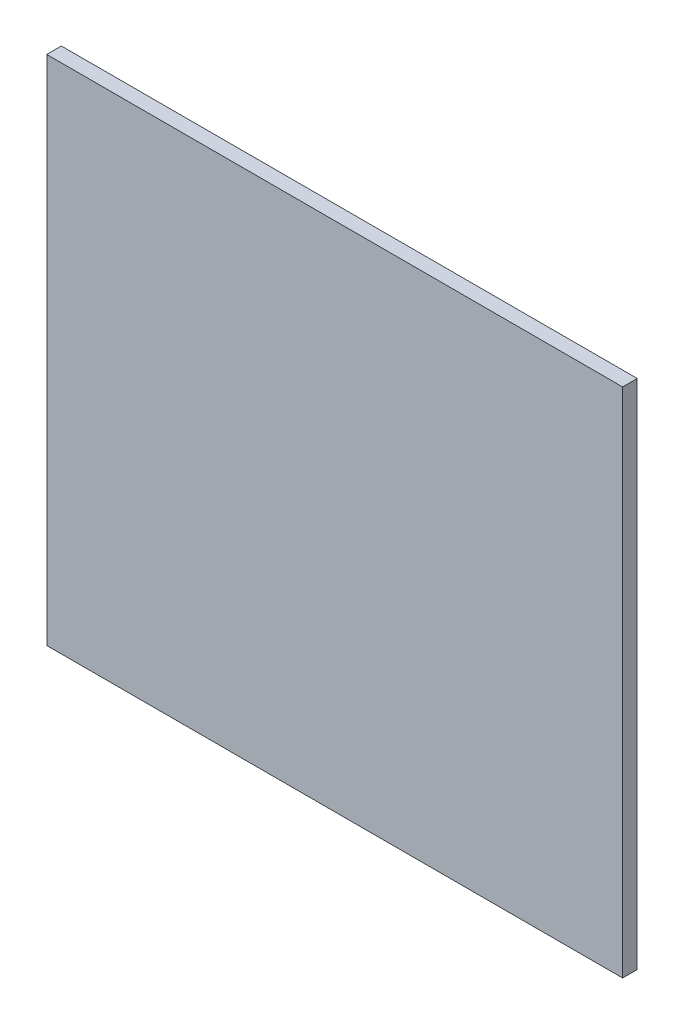
from build123d import *

# Parameters (mm, degrees)
SKETCH1_W           = 80.01
SKETCH1_H           = 71.12
BOSS_EXTRUDE1_DEPTH = 2.032


with BuildPart() as part:
    # Sketch1 → Boss-Extrude1 (new body)
    with BuildSketch(Plane.XY):
        with Locations((-40.005, 35.56)):
            Rectangle(SKETCH1_W, SKETCH1_H)
    extrude(amount=BOSS_EXTRUDE1_DEPTH)


solid = part.part
